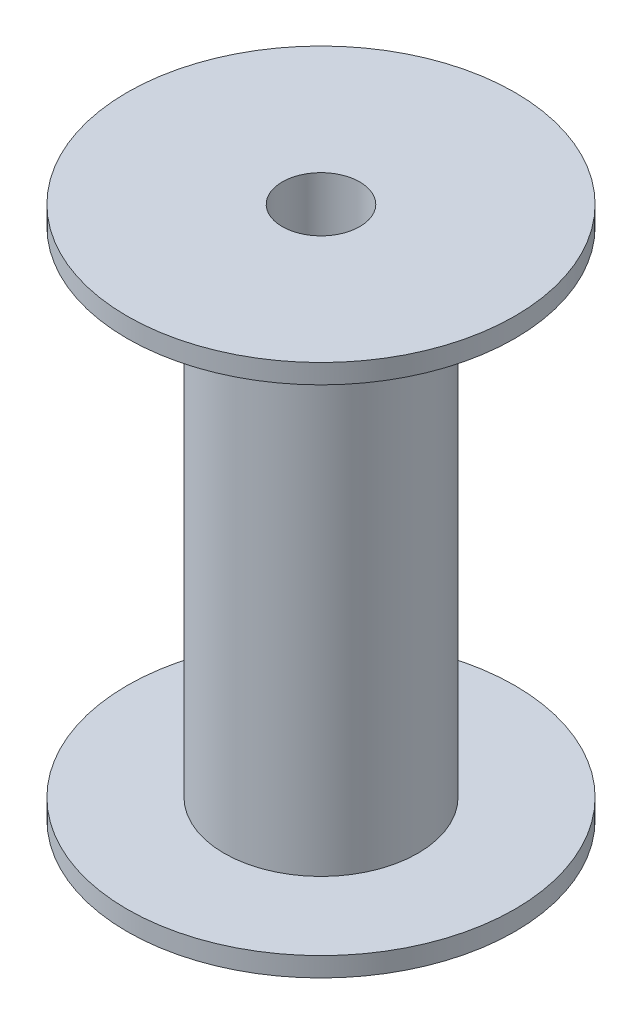
from build123d import *

# Parameters (mm, degrees)
SKETCH1_R           = 20
SKETCH1_R_2         = 4
BOSS_EXTRUDE1_DEPTH = 55
CUT_EXTRUDE4_START  = -53
SKETCH2_R           = 20
SKETCH2_R_2         = 10
CUT_EXTRUDE4_DEPTH  = 51


with BuildPart() as part:
    # Sketch1 → Boss-Extrude1 (new body)
    with BuildSketch(Plane(origin=(0, 0, 0), x_dir=(1, 0, 0), z_dir=(0, 1, 0))):
        with Locations(Location((0, 0, 0), (0, 0, 270))):
            Circle(SKETCH1_R)
        with Locations(Location((0, 0, 0), (0, 0, 270))):
            Circle(SKETCH1_R_2, mode=Mode.SUBTRACT)
    extrude(amount=BOSS_EXTRUDE1_DEPTH)

    # Sketch2 → Cut-Extrude4 (cut)
    with BuildSketch(Plane(origin=(0, 55, 0), x_dir=(1, 0, 0), z_dir=(0, 1, 0)).offset(CUT_EXTRUDE4_START)):
        with Locations(Location((0, 0, 0), (0, 0, 270))):
            Circle(SKETCH2_R)
        with Locations(Location((0, 0, 0), (0, 0, 270))):
            Circle(SKETCH2_R_2, mode=Mode.SUBTRACT)
    extrude(amount=CUT_EXTRUDE4_DEPTH, mode=Mode.SUBTRACT)


solid = part.part
